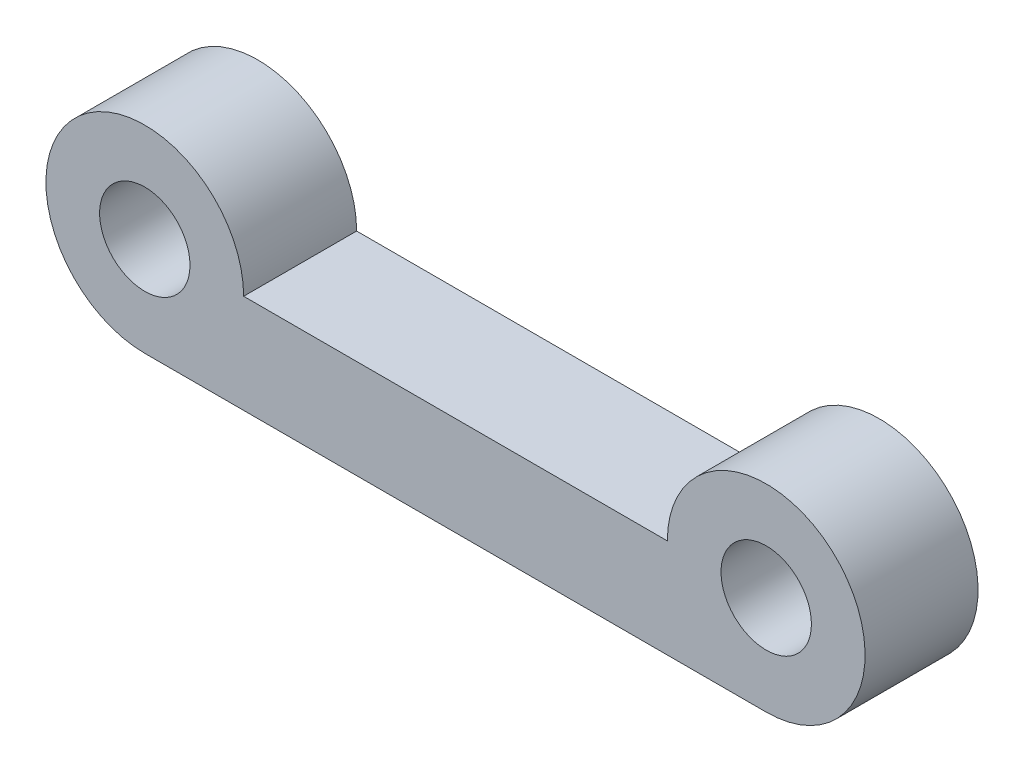
from build123d import *

# Parameters (mm, degrees)
SKETCH_1_R      = 1.6
EXTRUDE_1_DEPTH = 4


with BuildPart() as part:
    # ｽｹｯﾁ1 → ﾎﾞｽ - 押し出し1 (new body)
    with BuildSketch(Plane.XY):
        with BuildLine():
            Line((0, -3.5), (22, -3.5))
            ThreePointArc((22, -3.5), (24.474873734, 2.474873734), (18.5, 0))
            Line((18.5, 0), (3.5, 0))
            ThreePointArc((3.5, 0), (-2.474873734, 2.474873734), (0, -3.5))
        make_face()
        Circle(SKETCH_1_R, mode=Mode.SUBTRACT)
        with Locations((22, 0)):
            Circle(SKETCH_1_R, mode=Mode.SUBTRACT)
    extrude(amount=EXTRUDE_1_DEPTH)


solid = part.part
